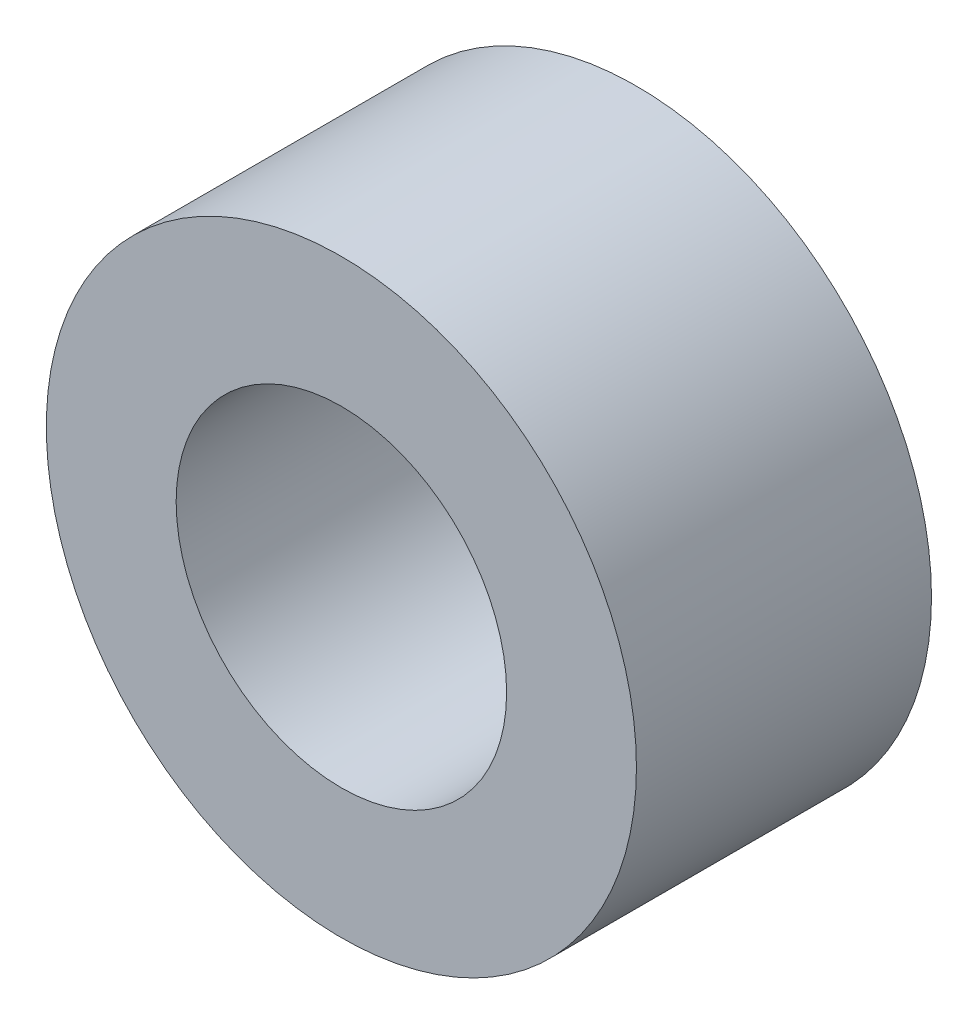
from build123d import *

# Parameters (mm, degrees)
SKETCH1_R           = 3.175
BOSS_EXTRUDE1_DEPTH = 3.175
SKETCH2_R           = 1.778
CUT_EXTRUDE1_DEPTH  = 3.175


with BuildPart() as part:
    # Sketch1 → Boss-Extrude1 (new body)
    with BuildSketch(Plane.XY):
        Circle(SKETCH1_R)
    extrude(amount=BOSS_EXTRUDE1_DEPTH)

    # Sketch2 → Cut-Extrude1 (cut)
    with BuildSketch(Plane.XY.offset(3.175)):
        Circle(SKETCH2_R)
    extrude(amount=-CUT_EXTRUDE1_DEPTH, mode=Mode.SUBTRACT)


solid = part.part
